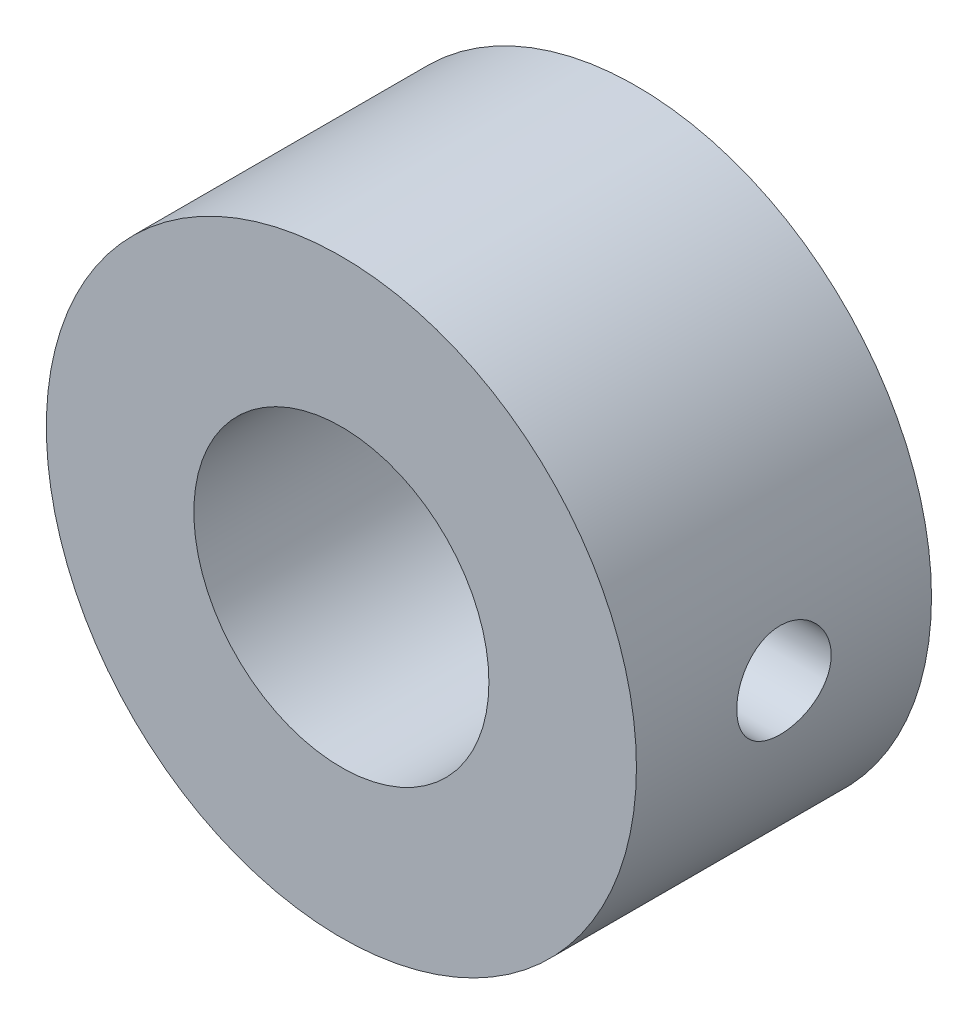
from build123d import *

# Parameters (mm, degrees)
SKETCH1_R           = 5
SKETCH1_R_2         = 2.5
BOSS_EXTRUDE1_DEPTH = 2.5
SKETCH2_W           = 0.8
SKETCH2_H           = 5


with BuildPart() as part:
    # Sketch1 → Boss-Extrude1 (new, symmetric)
    with BuildSketch(Plane.XY):
        Circle(SKETCH1_R)
        Circle(SKETCH1_R_2, mode=Mode.SUBTRACT)
    extrude(amount=BOSS_EXTRUDE1_DEPTH, both=True)

    # Sketch2 → M2x0.4 Tapped Hole1 (revolve, cut)
    with BuildSketch(Plane.ZX):
        with Locations((0.4, 2.5)):
            Rectangle(SKETCH2_W, SKETCH2_H)
    revolve(axis=Axis((-6.35, 0, 0), (1, 0, 0)), mode=Mode.SUBTRACT)


solid = part.part
